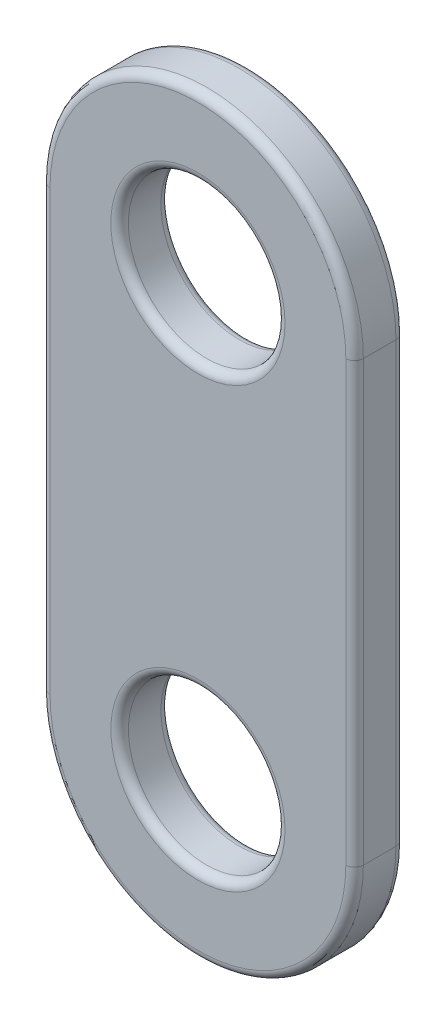
from build123d import *

# Parameters (mm, degrees)
SKETCH1_W           = 31.75
SKETCH1_H           = 76.2
SKETCH1_R           = 7.9375
BOSS_EXTRUDE1_DEPTH = 5.08
FILLET1_RADIUS      = 15.875
FILLET1_LENGTH      = 5.08
FILLET2_RADIUS      = 15.875
FILLET2_LENGTH      = 5.08
FILLET3_R           = 0.889


with BuildPart() as part:
    # Sketch1 → Boss-Extrude1 (new body)
    with BuildSketch(Plane.XY):
        Rectangle(SKETCH1_W, SKETCH1_H)
        with Locations((0, 22.225)):
            Circle(SKETCH1_R, mode=Mode.SUBTRACT)
        with Locations((0, -22.225)):
            Circle(SKETCH1_R, mode=Mode.SUBTRACT)
    extrude(amount=BOSS_EXTRUDE1_DEPTH)

    # Fillet1: full round fillet: the end face becomes a half cylinder, R = half its width
    fillet1_face = Plane((0, 38.1, 2.54), x_dir=(0, 0, 1), z_dir=(0, 1, 0))  # on the end face: x along it, z out of the body
    fillet1_slab = fillet1_face.offset(-FILLET1_RADIUS / 2) * Box(FILLET1_LENGTH, 2 * FILLET1_RADIUS, FILLET1_RADIUS, mode=Mode.PRIVATE)  # the body's end, R deep
    fillet1_round = Plane((0, 22.225, 2.54), x_dir=(0, 1, 0), z_dir=(0, 0, 1)) * Cylinder(FILLET1_RADIUS, FILLET1_LENGTH, mode=Mode.PRIVATE)  # its axis R under the face
    add(fillet1_slab - fillet1_round, mode=Mode.SUBTRACT)

    # Fillet2: full round fillet: the end face becomes a half cylinder, R = half its width
    fillet2_face = Plane((0, -38.1, 2.54), x_dir=(0, 0, 1), z_dir=(0, -1, 0))  # on the end face: x along it, z out of the body
    fillet2_slab = fillet2_face.offset(-FILLET2_RADIUS / 2) * Box(FILLET2_LENGTH, 2 * FILLET2_RADIUS, FILLET2_RADIUS, mode=Mode.PRIVATE)  # the body's end, R deep
    fillet2_round = Plane((0, -22.225, 2.54), x_dir=(0, -1, 0), z_dir=(0, 0, 1)) * Cylinder(FILLET2_RADIUS, FILLET2_LENGTH, mode=Mode.PRIVATE)  # its axis R under the face
    add(fillet2_slab - fillet2_round, mode=Mode.SUBTRACT)

    # Fillet3
    fillet3_edges = [part.edges().sort_by_distance(p)[0] for p in [
        (-7.9375, 22.225, 0),
        (-7.9375, 22.225, 5.08),
        (-7.9375, -22.225, 0),
        (-7.9375, -22.225, 5.08),
        (-15.875, 0, 0),
        (-15.875, 0, 5.08),
        (0, 38.1, 0),
        (0, 38.1, 5.08),
        (15.875, 0, 0),
        (15.875, 0, 5.08),
        (0, -38.1, 0),
        (0, -38.1, 5.08),
    ]]
    fillet(fillet3_edges, radius=FILLET3_R)


solid = part.part
